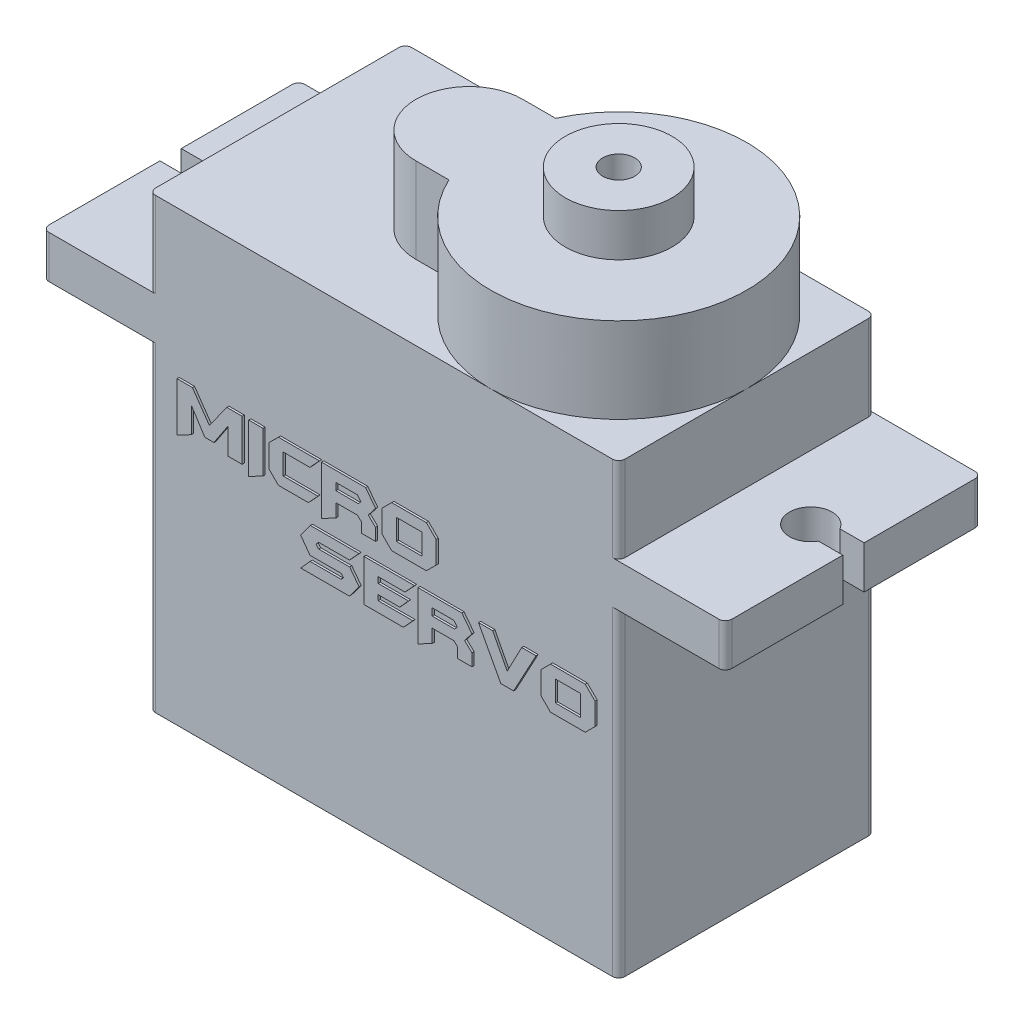
from build123d import *

# Parameters (mm, degrees)
SKETCH1_W           = 32
SKETCH1_H           = 12
BOSS_EXTRUDE1_DEPTH = 2
SKETCH2_W           = 22
SKETCH2_H           = 12
BOSS_EXTRUDE2_DEPTH = 15
SKETCH3_W           = 22
SKETCH3_H           = 12
BOSS_EXTRUDE3_DEPTH = 4
BOSS_EXTRUDE4_DEPTH = 4
BOSS_EXTRUDE5_DEPTH = 4
SKETCH6_R           = 2.5
SKETCH6_R_2         = 0.75
BOSS_EXTRUDE6_DEPTH = 2
SKETCH7_R           = 1
SKETCH7_W           = 5
SKETCH7_H           = 1
CUT_EXTRUDE1_DEPTH  = 25.103941586
FILLET1_R           = 0.3
SKETCH8_W           = 1.18990991
SKETCH8_H           = 0.976336336
SKETCH8_H_2         = 0.976336337
BOSS_EXTRUDE7_DEPTH = 0.1


with BuildPart() as part:
    # Sketch1 → Boss-Extrude1 (new body)
    with BuildSketch(Plane(origin=(0, 0, 0), x_dir=(1, 0, 0), z_dir=(0, 1, 0))):
        Rectangle(SKETCH1_W, SKETCH1_H)
    extrude(amount=BOSS_EXTRUDE1_DEPTH)

    # Sketch2 → Boss-Extrude2 (add)
    with BuildSketch(Plane.XZ):
        Rectangle(SKETCH2_W, SKETCH2_H)
    extrude(amount=BOSS_EXTRUDE2_DEPTH)

    # Sketch3 → Boss-Extrude3 (add)
    with BuildSketch(Plane(origin=(0, 2, 0), x_dir=(1, 0, 0), z_dir=(0, 1, 0))):
        Rectangle(SKETCH3_W, SKETCH3_H)
    extrude(amount=BOSS_EXTRUDE3_DEPTH)

    # Sketch4 → Boss-Extrude4 (add)
    with BuildSketch(Plane(origin=(0, 6, 0), x_dir=(1, 0, 0), z_dir=(0, 1, 0))):
        with BuildLine():
            ThreePointArc((9.242640687, 4.242640687), (7.296100594, 5.543277195), (5, 6))
            ThreePointArc((5, 6), (0.757359313, 4.242640687), (-1, 0))
            ThreePointArc((-1, 0), (-0.543277195, -2.296100594), (0.757359313, -4.242640687))
            Line((0.757359313, -4.242640687), (9.242640687, 4.242640687))
        make_face()
        with BuildLine():
            ThreePointArc((11, 0), (10.543277195, 2.296100594), (9.242640687, 4.242640687))
            Line((9.242640687, 4.242640687), (0.757359313, -4.242640687))
            ThreePointArc((0.757359313, -4.242640687), (7.296100594, -5.543277195), (11, 0))
        make_face()
    extrude(amount=BOSS_EXTRUDE4_DEPTH)

    # Sketch5 → Boss-Extrude5 (add)
    with BuildSketch(Plane(origin=(0, 6, 0), x_dir=(1, 0, 0), z_dir=(0, 1, 0))):
        with BuildLine():
            ThreePointArc((-1, 0), (-0.862002062, 1.279426367), (-0.454356057, 2.5))
            Line((-0.454356057, 2.5), (-2, 2.5))
            ThreePointArc((-2, 2.5), (-4.5, 0), (-2, -2.5))
            Line((-2, -2.5), (-0.454356057, -2.5))
            ThreePointArc((-0.454356057, -2.5), (-0.862002062, -1.279426367), (-1, 0))
        make_face()
    extrude(amount=BOSS_EXTRUDE5_DEPTH)

    # Sketch6 → Boss-Extrude6 (add)
    with BuildSketch(Plane(origin=(0, 10, 0), x_dir=(1, 0, 0), z_dir=(0, 1, 0))):
        with Locations(Location((5, 0, 0), (0, 0, 270))):
            Circle(SKETCH6_R)
        with Locations(Location((5, 0, 0), (0, 0, 270))):
            Circle(SKETCH6_R_2, mode=Mode.SUBTRACT)
    extrude(amount=BOSS_EXTRUDE6_DEPTH)

    # Sketch7 → Cut-Extrude1 (cut, through all)
    with BuildSketch(Plane(origin=(0, 2, 0), x_dir=(1, 0, 0), z_dir=(0, 1, 0))):
        with Locations((14, 0)):
            Circle(SKETCH7_R)
        with Locations((-14, 0)):
            Circle(SKETCH7_R)
        with Locations((16, 0)):
            Rectangle(SKETCH7_W, SKETCH7_H)
        with Locations((-16, 0)):
            Rectangle(SKETCH7_W, SKETCH7_H)
    extrude(amount=-CUT_EXTRUDE1_DEPTH, mode=Mode.SUBTRACT)

    # Fillet1
    fillet1_edges = [part.edges().sort_by_distance(p)[0] for p in [
        (11, 4, -6),
        (11, -7.5, -6),
        (11, 4, 6),
        (11, -7.5, 6),
        (-11, 4, -6),
        (-11, 4, 6),
        (-11, -7.5, 6),
        (-11, -7.5, -6),
        (-16, 1, -6),
        (-16, 1, 6),
        (16, 1, -6),
        (16, 1, 6),
    ]]
    fillet(fillet1_edges, radius=FILLET1_R)

    # Sketch8 → Boss-Extrude7 (add)
    # profile 1 of 10: a face of its own
    with BuildSketch(Plane.XY.offset(6)):
        Polygon((-6.546228955, -2.789688189), (-7.217460186, -2.789688189), (-7.217460186, -1.581662663), (-7.868192168, -2.564673174), (-8.295339315, -2.564673174), (-8.926048774, -1.582616117), (-8.926048774, -2.775386387), (-9.597280006, -3.125303805), (-9.597280006, -0.837015516), (-8.876469195, -0.837015516), (-8.079858834, -1.98115966), (-7.268469946, -0.837015516), (-6.546228955, -0.837015516), align=None)
    # profile 2 of 10: a face of its own
    with BuildSketch(Plane.XY.offset(6)):
        Polygon((-5.569892618, -2.778246748), (-6.241123849, -3.125303805), (-6.241123849, -0.837015516), (-5.569892618, -0.837015516), align=None)
    # profile 3 of 10: a face of its own
    with BuildSketch(Plane.XY.offset(6)):
        Polygon((-2.923582558, -0.837015516), (-3.373135861, -1.325183685), (-4.624066792, -1.325183685), (-4.624066792, -2.301520021), (-2.99175448, -2.301520021), (-3.445121597, -2.789688189), (-4.84431454, -2.789688189), (-5.295298024, -2.344902153), (-5.295298024, -1.285138639), (-4.84431454, -0.837015516), align=None)
    # profile 4 of 10: a face of its own
    with BuildSketch(Plane.XY.offset(6)):
        Polygon((-0.2915743, -2.789688189), (-0.962805531, -2.789688189), (-0.962805531, -2.31772873), (-1.138717693, -2.148967468), (-2.152715441, -2.148967468), (-2.152715441, -2.770142393), (-2.823946672, -3.125303805), (-2.823946672, -0.837015516), (-0.762580306, -0.837015516), (-0.2915743, -1.45103954), (-0.63672445, -1.892488489), (-0.2915743, -2.219999751), align=None)
        Polygon((-0.981397873, -1.52397873), (-1.143008234, -1.325183685), (-2.152715441, -1.325183685), (-2.152715441, -1.6607993), (-1.096765741, -1.6607993), align=None, mode=Mode.SUBTRACT)
    # profile 5 of 10: a face of its own
    with BuildSketch(Plane.XY.offset(6)):
        Polygon((2.545903178, -2.332507258), (2.08824552, -2.789688189), (0.461653928, -2.789688189), (0.013530805, -2.342041793), (0.013530805, -1.285138639), (0.462130655, -0.837015516), (2.087768793, -0.837015516), (2.545903178, -1.294673174), align=None)
        with Locations((1.279716991, -1.813351853)):
            Rectangle(SKETCH8_W, SKETCH8_H, mode=Mode.SUBTRACT)
    # profile 6 of 10: a face of its own
    with BuildSketch(Plane.XY.offset(6)):
        Polygon((-1.064397577, -5.019272635), (-1.519194874, -5.623285398), (-3.801285715, -5.623285398), (-3.361266946, -5.13511723), (-1.916784964, -5.13511723), (-1.799033463, -5.025946809), (-1.91154097, -4.891033146), (-3.366987667, -4.891033146), (-3.801285715, -4.292741103), (-3.352685865, -3.670612725), (-1.064397577, -3.670612725), (-1.517764694, -4.158780893), (-2.964153583, -4.158780893), (-3.079044724, -4.29178765), (-2.963200129, -4.433375488), (-1.507753433, -4.433375488), align=None)
    # profile 7 of 10: a face of its own
    with BuildSketch(Plane.XY.offset(6)):
        Polygon((1.52994927, -3.670612725), (1.080395967, -4.158780893), (-0.170534964, -4.158780893), (-0.170534964, -4.433375488), (1.251540862, -4.433375488), (0.837265336, -4.891033146), (-0.170534964, -4.891033146), (-0.170534964, -5.13511723), (1.461777348, -5.13511723), (1.008410231, -5.623285398), (-0.841766195, -5.623285398), (-0.841766195, -3.670612725), align=None)
    # profile 8 of 10: a face of its own
    with BuildSketch(Plane.XY.offset(6)):
        Polygon((4.222978549, -5.623285398), (3.551747318, -5.623285398), (3.551747318, -5.151325938), (3.375835156, -4.982564677), (2.361837408, -4.982564677), (2.361837408, -5.603739602), (1.690606177, -5.958901013), (1.690606177, -3.670612725), (3.751972543, -3.670612725), (4.222978549, -4.284636749), (3.877828399, -4.726085698), (4.222978549, -5.053596959), align=None)
        Polygon((3.533154976, -4.357575938), (3.371544615, -4.158780893), (2.361837408, -4.158780893), (2.361837408, -4.494396509), (3.417787108, -4.494396509), align=None, mode=Mode.SUBTRACT)
    # profile 9 of 10: a face of its own
    with BuildSketch(Plane.XY.offset(6)):
        Polygon((7.226356928, -3.670612725), (6.175174495, -5.623285398), (5.574975546, -5.623285398), (4.528083654, -3.670612725), (5.194070892, -3.670612725), (5.874836657, -4.972553416), (6.555602423, -3.670612725), align=None)
    # profile 10 of 10: a face of its own
    with BuildSketch(Plane.XY.offset(6)):
        Polygon((9.989465036, -5.166104467), (9.531807378, -5.623285398), (7.905215787, -5.623285398), (7.457092663, -5.175639001), (7.457092663, -4.118735848), (7.905692513, -3.670612725), (9.531330651, -3.670612725), (9.989465036, -4.128270383), align=None)
        with Locations((8.72327885, -4.646949062)):
            Rectangle(SKETCH8_W, SKETCH8_H_2, mode=Mode.SUBTRACT)
    extrude(amount=BOSS_EXTRUDE7_DEPTH)


solid = part.part
